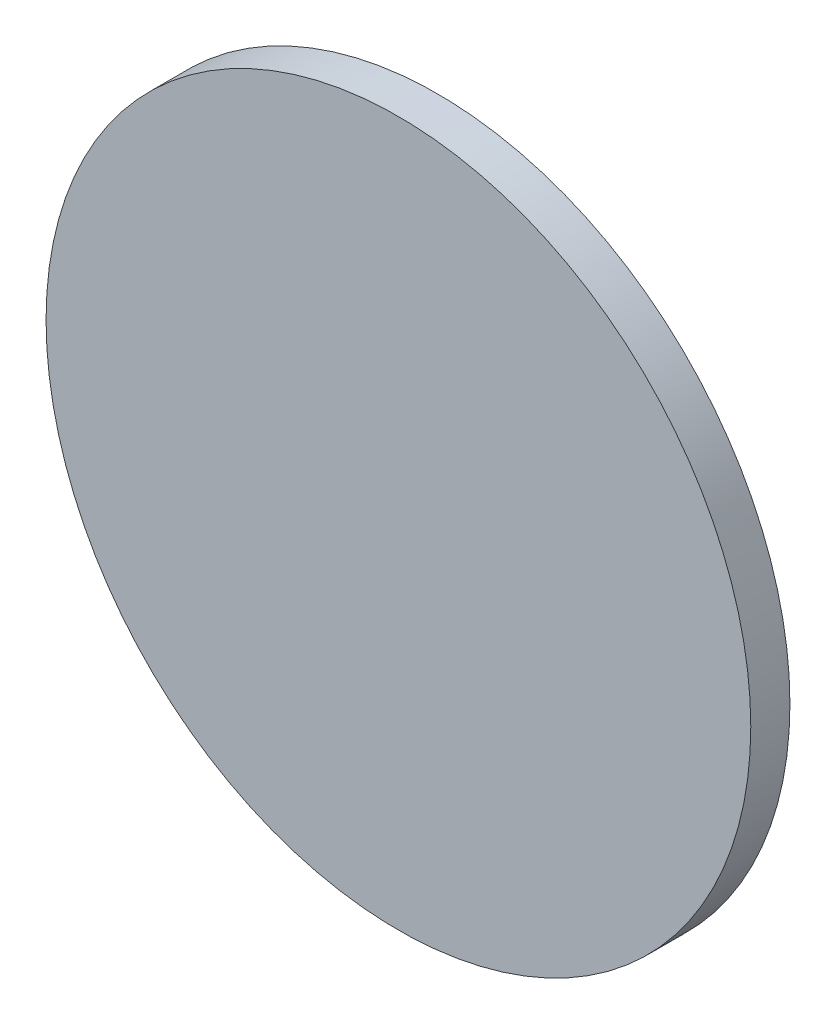
from build123d import *

# Parameters (mm, degrees)
SKETCH1_R      = 228.6
EXTRUDE1_DEPTH = 25.4


with BuildPart() as part:
    # Sketch1 → Extrude1 (new body)
    with BuildSketch(Plane.XY):
        Circle(SKETCH1_R)
    extrude(amount=-EXTRUDE1_DEPTH)


solid = part.part
